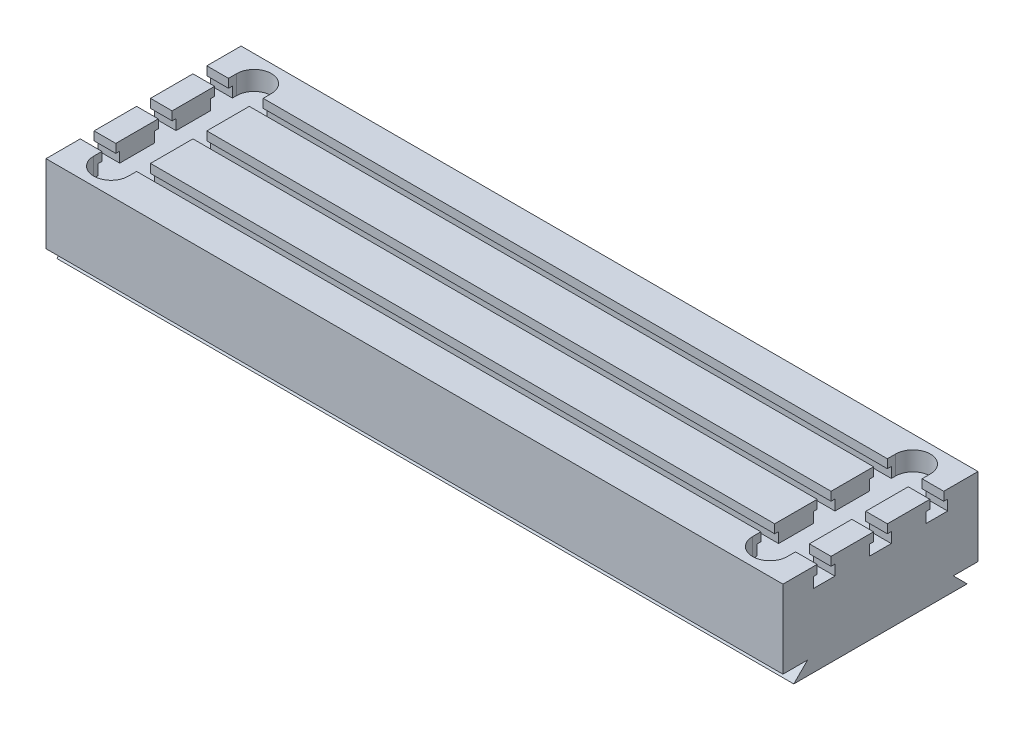
from build123d import *

# Parameters (mm, degrees)
SKETCH1_W           = 850
SKETCH1_H           = 225
BOSS_EXTRUDE1_DEPTH = 106
CUT_EXTRUDE1_DEPTH  = 850
CUT_EXTRUDE2_DEPTH  = 850
CUT_EXTRUDE3_DEPTH  = 22


with BuildPart() as part:
    # Sketch1 → Boss-Extrude1 (new body)
    with BuildSketch(Plane(origin=(0, 0, 0), x_dir=(1, 0, 0), z_dir=(0, 1, 0))):
        with Locations((-425, -112.5)):
            Rectangle(SKETCH1_W, SKETCH1_H)
    extrude(amount=BOSS_EXTRUDE1_DEPTH)

    # Sketch2 → Cut-Extrude1 (cut)
    with BuildSketch(Plane(origin=(0, 0, 0), x_dir=(0, 0, -1), z_dir=(1, 0, 0))):
        Polygon((-225, 16), (-196.5, 16), (-212.5, 0), (-225, 0), align=None)
        Polygon((0, 0), (-12.5, 0), (-28.5, 16), (0, 16), align=None)
    extrude(amount=-CUT_EXTRUDE1_DEPTH, mode=Mode.SUBTRACT)

    # Sketch3 → Cut-Extrude2 (cut)
    with BuildSketch(Plane(origin=(0, 0, 0), x_dir=(0, 0, -1), z_dir=(1, 0, 0))):
        Polygon((-169.5, 96), (-169.5, 106), (-185.5, 106), (-185.5, 96), (-190, 96), (-190, 84), (-165, 84), (-165, 96), align=None)
        Polygon((-39.5, 106), (-55.5, 106), (-55.5, 96), (-60, 96), (-60, 84), (-35, 84), (-35, 96), (-39.5, 96), align=None)
        Polygon((-104.5, 106), (-120.5, 106), (-120.5, 96), (-125, 96), (-125, 84), (-100, 84), (-100, 96), (-104.5, 96), align=None)
    extrude(amount=-CUT_EXTRUDE2_DEPTH, mode=Mode.SUBTRACT)

    # Sketch4 → Cut-Extrude3 (cut)
    with BuildSketch(Plane(origin=(0, 106, 0), x_dir=(1, 0, 0), z_dir=(0, 1, 0))):
        with BuildLine():
            Line((-825, -185.5), (-785, -185.5))
            Line((-785, -185.5), (-785, -30))
            ThreePointArc((-785, -30), (-805, -10), (-825, -30))
            Line((-825, -30), (-825, -185.5))
        make_face()
        with BuildLine():
            Line((-785, -195), (-785, -185.5))
            Line((-785, -185.5), (-825, -185.5))
            Line((-825, -185.5), (-825, -195))
            ThreePointArc((-825, -195), (-805, -215), (-785, -195))
        make_face()
        with BuildLine():
            Line((-65, -185.5), (-65, -195))
            ThreePointArc((-65, -195), (-45, -215), (-25, -195))
            Line((-25, -195), (-25, -185.5))
            Line((-25, -185.5), (-65, -185.5))
        make_face()
        with BuildLine():
            Line((-65, -30), (-65, -185.5))
            Line((-65, -185.5), (-25, -185.5))
            Line((-25, -185.5), (-25, -30))
            ThreePointArc((-25, -30), (-45, -10), (-65, -30))
        make_face()
    extrude(amount=-CUT_EXTRUDE3_DEPTH, mode=Mode.SUBTRACT)


solid = part.part
